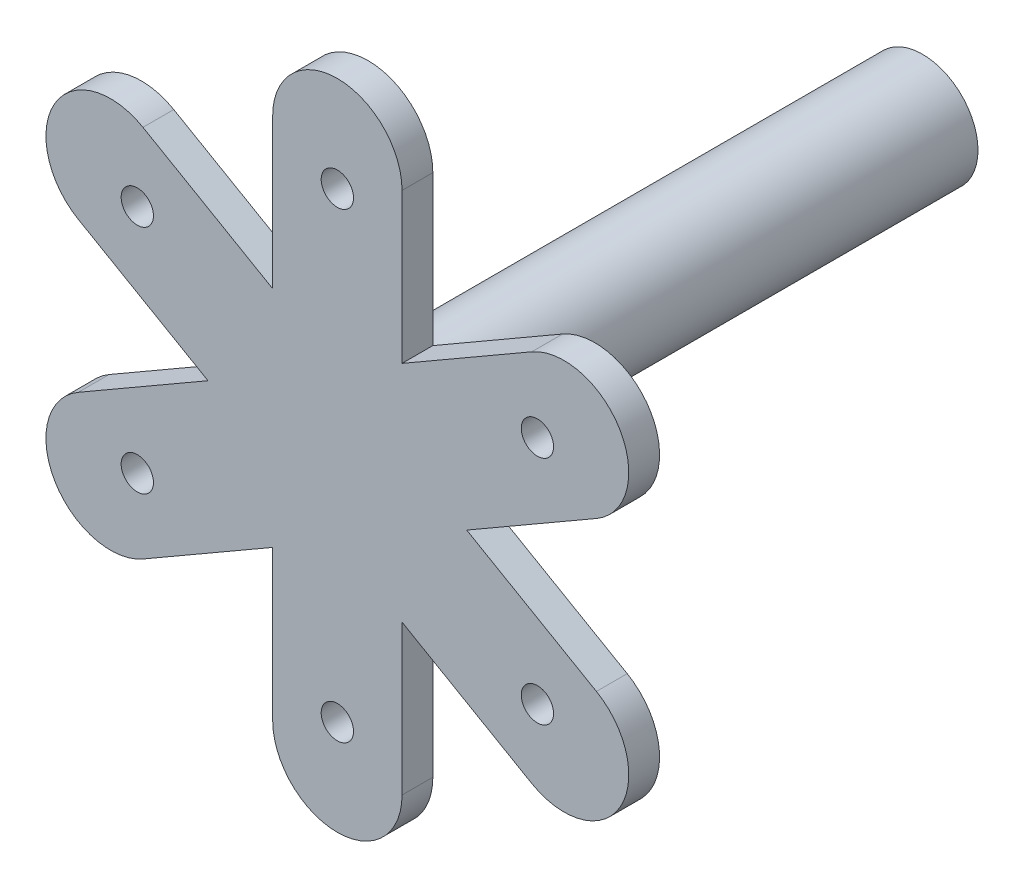
from build123d import *

# Parameters (mm, degrees)
SKETCH_1_R      = 5.25
EXTRUDE_1_DEPTH = 10
SKETCH_2_R      = 18
EXTRUDE_2_DEPTH = 180


with BuildPart() as part:
    # 草图1 → 凸台-拉伸1 (new body)
    with BuildSketch(Plane.XY):
        with BuildLine():
            Line((21, 0), (21, -48.626933041))
            Line((21, -48.626933041), (63.112159322, -24.313466521))
            ThreePointArc((63.112159322, -24.313466521), (91.798692801, -32), (84.112159322, -60.686533479))
            Line((84.112159322, -60.686533479), (42, -85))
            Line((42, -85), (84.112159322, -109.313466521))
            ThreePointArc((84.112159322, -109.313466521), (91.798692801, -138), (63.112159322, -145.686533479))
            Line((63.112159322, -145.686533479), (21, -121.373066959))
            Line((21, -121.373066959), (21, -170))
            ThreePointArc((21, -170), (0, -191), (-21, -170))
            Line((-21, -170), (-21, -121.373066959))
            Line((-21, -121.373066959), (-63.112159322, -145.686533479))
            ThreePointArc((-63.112159322, -145.686533479), (-91.798692801, -138), (-84.112159322, -109.313466521))
            Line((-84.112159322, -109.313466521), (-42, -85))
            Line((-42, -85), (-84.112159322, -60.686533479))
            ThreePointArc((-84.112159322, -60.686533479), (-91.798692801, -32), (-63.112159322, -24.313466521))
            Line((-63.112159322, -24.313466521), (-21, -48.626933041))
            Line((-21, -48.626933041), (-21, 0))
            ThreePointArc((-21, 0), (0, 21), (21, 0))
        make_face()
        with Locations((0, -10)):
            Circle(SKETCH_1_R, mode=Mode.SUBTRACT)
        with Locations((64.951905284, -47.5)):
            Circle(SKETCH_1_R, mode=Mode.SUBTRACT)
        with Locations((64.951905284, -122.5)):
            Circle(SKETCH_1_R, mode=Mode.SUBTRACT)
        with Locations((0, -160)):
            Circle(SKETCH_1_R, mode=Mode.SUBTRACT)
        with Locations((-64.951905284, -122.5)):
            Circle(SKETCH_1_R, mode=Mode.SUBTRACT)
        with Locations((-64.951905284, -47.5)):
            Circle(SKETCH_1_R, mode=Mode.SUBTRACT)
    extrude(amount=EXTRUDE_1_DEPTH)

    # 草图2 → 凸台-拉伸2 (add)
    with BuildSketch(Plane(origin=(0, 0, 0), x_dir=(-1, 0, 0), z_dir=(0, 0, -1))):
        with Locations(Location((0, -85.20347481, 0), (0, 0, 180))):
            Circle(SKETCH_2_R)
    extrude(amount=EXTRUDE_2_DEPTH)


solid = part.part
